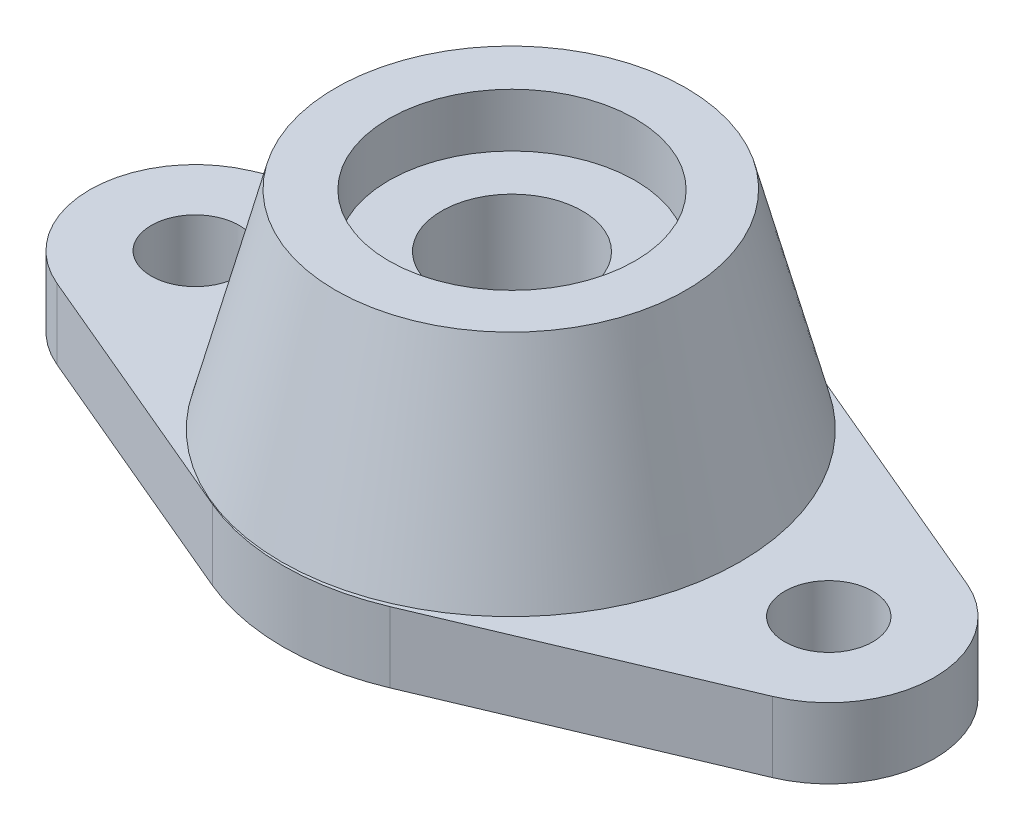
from build123d import *

# Parameters (mm, degrees)
SKETCH1_R           = 7.9375
BOSS_EXTRUDE1_DEPTH = 12.7


with BuildPart() as part:
    # Sketch1 → Boss-Extrude1 (new body)
    with BuildSketch(Plane(origin=(0, 0, 0), x_dir=(1, 0, 0), z_dir=(0, 1, 0))):
        with BuildLine():
            Line((-64.558333333, 17.550472849), (-16.051388889, 38.026024506))
            ThreePointArc((-16.051388889, 38.026024506), (0, 41.275), (16.051388889, 38.026024506))
            Line((16.051388889, 38.026024506), (64.558333333, 17.550472849))
            ThreePointArc((64.558333333, 17.550472849), (76.2, 0), (64.558333333, -17.550472849))
            Line((64.558333333, -17.550472849), (16.051388889, -38.026024506))
            ThreePointArc((16.051388889, -38.026024506), (0, -41.275), (-16.051388889, -38.026024506))
            Line((-16.051388889, -38.026024506), (-64.558333333, -17.550472849))
            ThreePointArc((-64.558333333, -17.550472849), (-76.2, 0), (-64.558333333, 17.550472849))
        make_face()
        with Locations(Location((-57.15, 0, 0), (0, 0, 270))):
            Circle(SKETCH1_R, mode=Mode.SUBTRACT)
        with Locations(Location((57.15, 0, 0), (0, 0, 270))):
            Circle(SKETCH1_R, mode=Mode.SUBTRACT)
    extrude(amount=BOSS_EXTRUDE1_DEPTH)


with BuildPart() as body_2:
    # Sketch2 → Revolve1 (revolve)
    with BuildSketch(Plane.XY, mode=Mode.PRIVATE) as revolve1_sk:
        Polygon((-0.217540434, 13.267695424), (-0.217540434, 50.8), (31.400329789, 50.8), (41.184459566, 13.267695424), align=None)
    revolve(revolve1_sk.sketch.rotate(Axis((-0.217540434, 13.267695424, 0), (0, 1, 0)), 90), axis=Axis((-0.217540434, 13.267695424, 0), (0, 1, 0)))


with BuildPart() as cut_revolve1_tool:
    # Sketch3 → Cut-Revolve1 (revolve)
    with BuildSketch(Plane.XY):
        Polygon((0, 50.8), (22.225, 50.8), (22.225, 41.148), (12.7, 41.148), (12.7, 25.4), (19.05, 19.05), (19.05, 13.267695424), (19.05, 0), (0, 0), align=None)
    revolve(axis=Axis((0, 50.8, 0), (0, -1, 0)))


with BuildPart() as part_1:
    add(part.part)

    # Cut-Revolve1: cut by cut_revolve1_tool
    add(cut_revolve1_tool.part, mode=Mode.SUBTRACT)


with BuildPart() as body_2_1:
    add(body_2.part)

    # Cut-Revolve1: cut by cut_revolve1_tool
    add(cut_revolve1_tool.part, mode=Mode.SUBTRACT)


solid = Compound([part_1.part, body_2_1.part])
